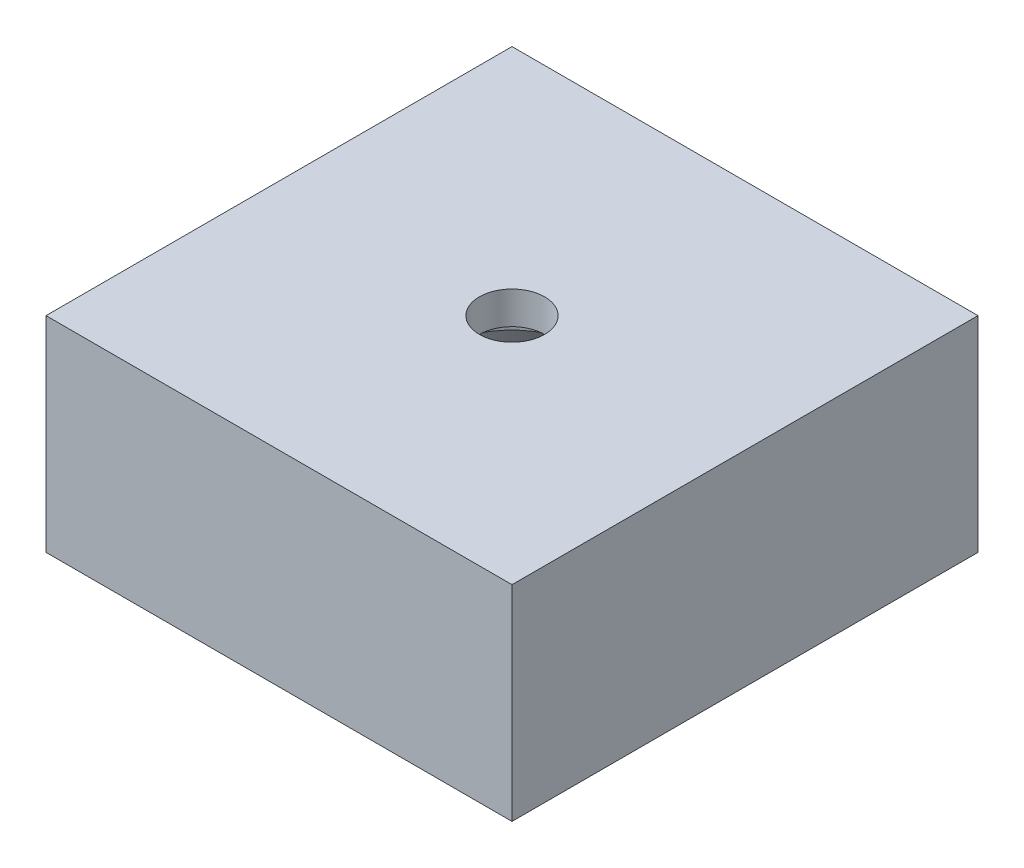
from build123d import *

# Parameters (mm, degrees)
BOSS_EXTRUDE1_DEPTH      = 11
BOSS_EXTRUDE1_DEPTH_BACK = 11
SKETCH1_W                = 50
SKETCH1_H                = 50


with BuildPart() as part:
    # Sketch1 → Boss-Extrude1 (new, two sides: drawn at the far end of the back side and taken through both)
    with BuildSketch(Plane(origin=(0, 0, 0), x_dir=(1, 0, 0), z_dir=(0, 1, 0)).offset(-BOSS_EXTRUDE1_DEPTH_BACK)):
        Rectangle(SKETCH1_W, SKETCH1_H)
    extrude(amount=BOSS_EXTRUDE1_DEPTH + BOSS_EXTRUDE1_DEPTH_BACK)

    # Sketch2 → Cut-Revolve1 (revolve, cut)
    with BuildSketch(Plane.XY):
        Polygon((-3.5, 7.5), (-3.5, 11), (0, 11), (0, -11), (-18, -11), (-10.5, 4), (-8, 4), (-8, 7.5), align=None)
    revolve(axis=Axis((0, 11, 0), (0, -1, 0)), mode=Mode.SUBTRACT)


solid = part.part
